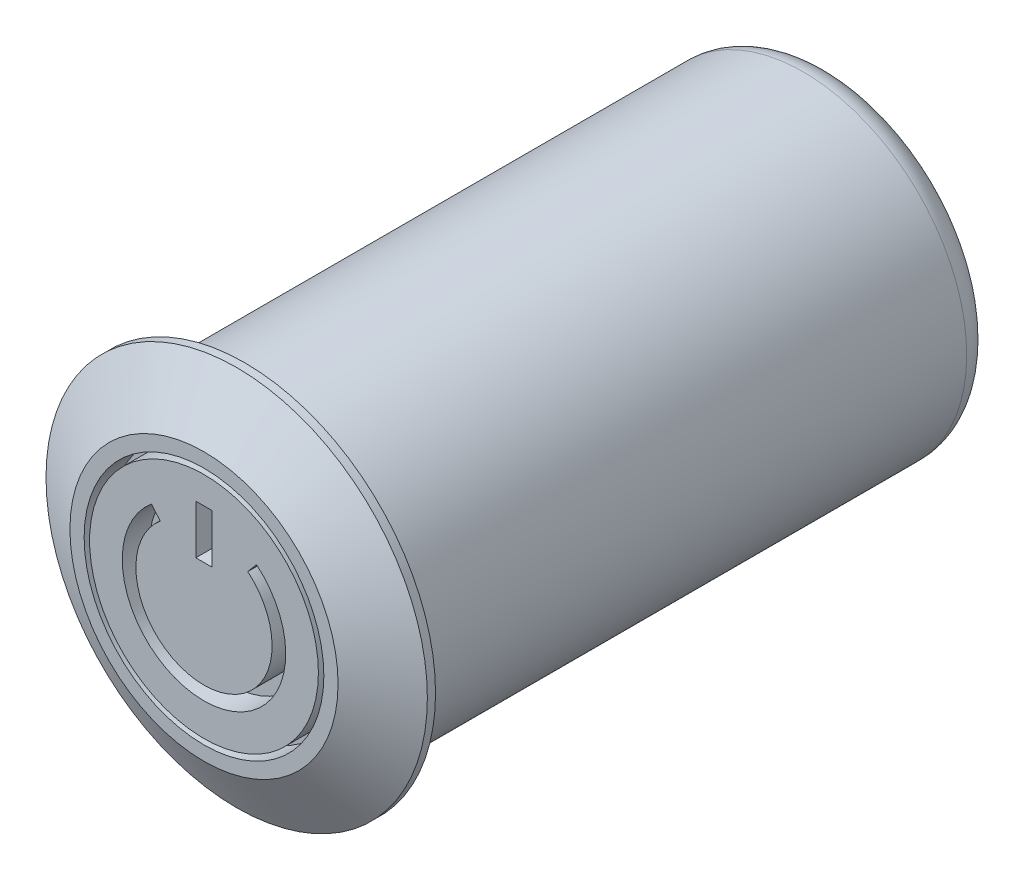
from build123d import *

# Parameters (mm, degrees)
SKETCH_1_R          = 7
EXTRUDE_1_DEPTH     = 1.5
CHAMFER_1_SIZE      = 1.2
CHAMFER_1_SIZE2     = 2.078460969
SKETCH_2_R          = 4.4
SKETCH_2_R_2        = 4.2
CUT_EXTRUDE_1_DEPTH = 1
SKETCH_3_R          = 6
EXTRUDE_2_DEPTH     = 21.5
FILLET_1_R          = 1


with BuildPart() as part:
    # 草图1 → 凸台-拉伸1 (new body)
    with BuildSketch(Plane.XY):
        Circle(SKETCH_1_R)
    extrude(amount=EXTRUDE_1_DEPTH)

    # 倒角1
    chamfer_1_edges = [part.edges().sort_by_distance(p)[0] for p in [
        (-7, 0, 1.5),
    ]]
    chamfer_1_side = [part.faces().sort_by_distance(p)[0] for p in [
        (-7, 0, 0.75),
    ]]
    chamfer(chamfer_1_edges, length=CHAMFER_1_SIZE, length2=CHAMFER_1_SIZE2, reference=chamfer_1_side[0])

    # 草图2 → 切除-拉伸1 (cut)
    # profile 1 of 3: a face of its own
    with BuildSketch(Plane.XY.offset(1.5)):
        Circle(SKETCH_2_R)
        Circle(SKETCH_2_R_2, mode=Mode.SUBTRACT)
    # profile 2 of 3: a face of its own
    with BuildSketch(Plane.XY.offset(1.5)):
        with BuildLine():
            Line((-1.606969024, 1.915111108), (-1.928362829, 2.298133329))
            ThreePointArc((-1.928362829, 2.298133329), (0, -3), (1.928362829, 2.298133329))
            Line((1.928362829, 2.298133329), (1.606969024, 1.915111108))
            ThreePointArc((1.606969024, 1.915111108), (0, -2.5), (-1.606969024, 1.915111108))
        make_face()
    # profile 3 of 3: a face of its own
    with BuildSketch(Plane.XY.offset(1.5)):
        Polygon((-0.3, 1.4), (0.3, 1.4), (0.3, 3.2), (0, 3.2), (-0.3, 3.2), align=None)
    extrude(amount=-CUT_EXTRUDE_1_DEPTH, mode=Mode.SUBTRACT)

    # 草图3 → 凸台-拉伸2 (add)
    with BuildSketch(Plane(origin=(0, 0, 0), x_dir=(-1, 0, 0), z_dir=(0, 0, -1))):
        with Locations(Location((0, 0, 0), (0, 0, 180))):
            Circle(SKETCH_3_R)
    extrude(amount=EXTRUDE_2_DEPTH)

    # 圆角1
    fillet_1_edges = [part.edges().sort_by_distance(p)[0] for p in [
        (-6, 0, -21.5),
    ]]
    fillet(fillet_1_edges, radius=FILLET_1_R)


solid = part.part
